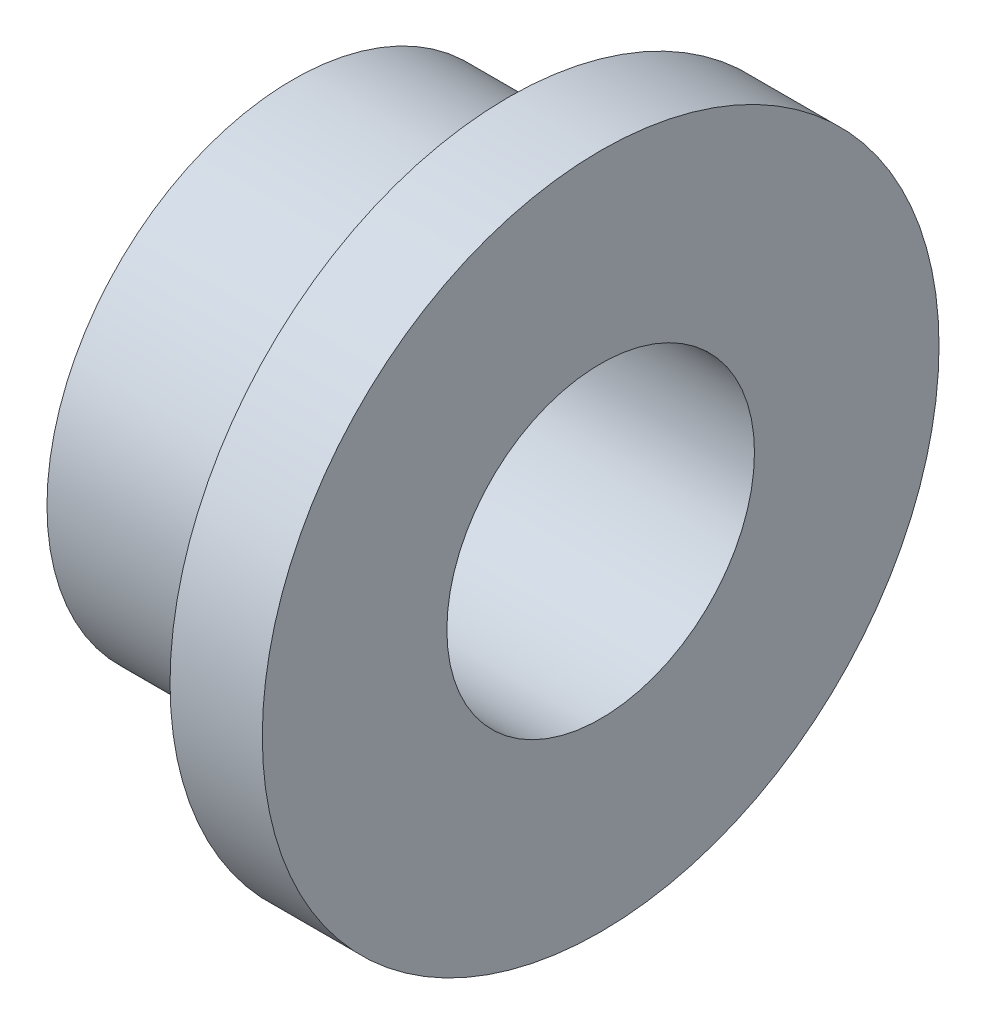
from build123d import *


with BuildPart() as part:
    # Sketch1 → Revolve1 (revolve)
    with BuildSketch(Plane.XY, mode=Mode.PRIVATE) as revolve1_sk:
        Polygon((0, 8), (7, 8), (7, 11), (10, 11), (10, 5), (0, 5), align=None)
    revolve(revolve1_sk.sketch.rotate(Axis((0, 0, 0), (1, 0, 0)), 90), axis=Axis((0, 0, 0), (1, 0, 0)))


solid = part.part
